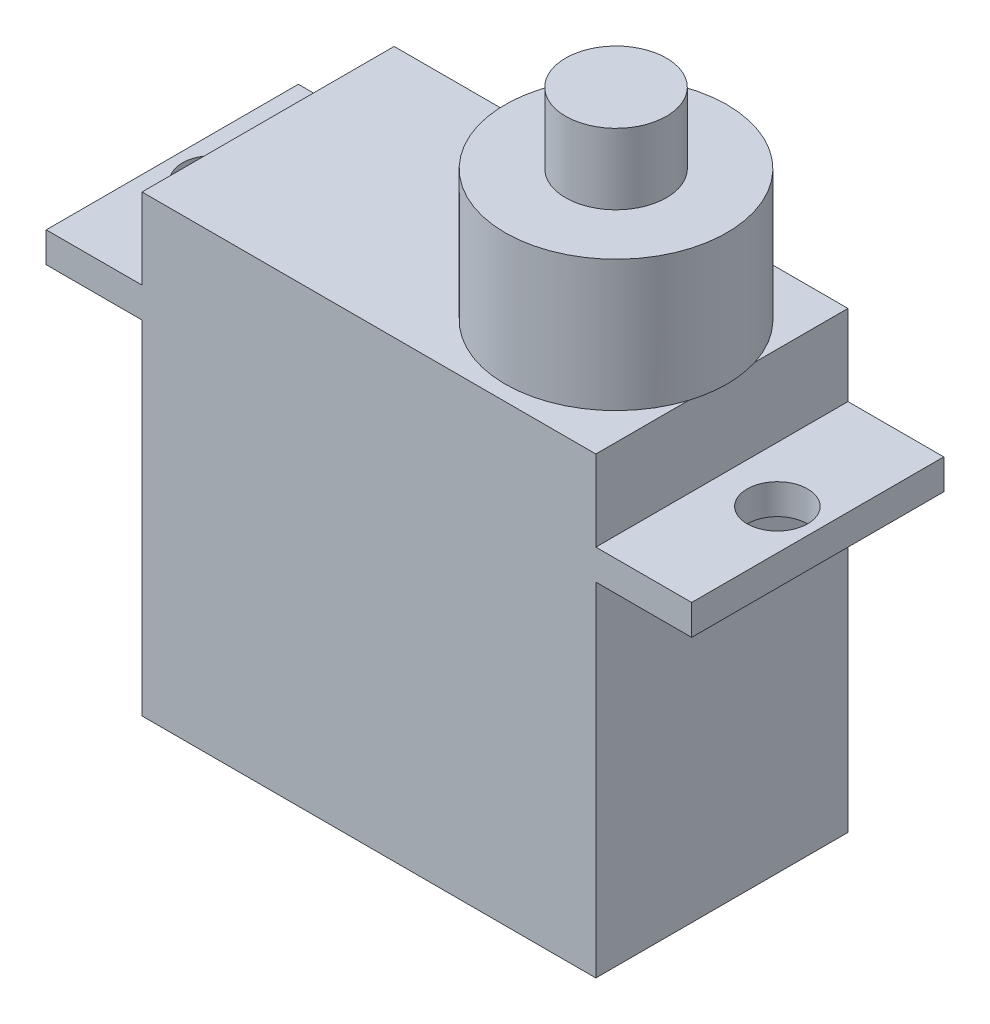
from build123d import *

# Parameters (mm, degrees)
SKETCH_1_W      = 22.5
SKETCH_1_H      = 12.5
EXTRUDE_1_DEPTH = 17
SKETCH_2_W      = 32
SKETCH_2_H      = 12.5
SKETCH_2_R      = 1.5
EXTRUDE_2_DEPTH = 1.5
SKETCH_3_W      = 22.5
SKETCH_3_H      = 12.5
EXTRUDE_3_DEPTH = 4
SKETCH_4_R      = 5.5
EXTRUDE_4_DEPTH = 6.5
SKETCH_5_R      = 2.5
EXTRUDE_5_DEPTH = 3.5


with BuildPart() as part:
    # 草图1 → 凸台-拉伸1 (new body)
    with BuildSketch(Plane(origin=(0, 0, 0), x_dir=(1, 0, 0), z_dir=(0, 1, 0))):
        with Locations((11.25, -6.25)):
            Rectangle(SKETCH_1_W, SKETCH_1_H)
    extrude(amount=EXTRUDE_1_DEPTH)

    # 草图2 → 凸台-拉伸2 (add)
    with BuildSketch(Plane(origin=(0, 17, 0), x_dir=(1, 0, 0), z_dir=(0, 1, 0))):
        with Locations((11.25, -6.25)):
            Rectangle(SKETCH_2_W, SKETCH_2_H)
        with Locations(Location((-2.75, -6.25, 0), (0, 0, 270))):
            Circle(SKETCH_2_R, mode=Mode.SUBTRACT)
        with Locations(Location((25.25, -6.25, 0), (0, 0, 270))):
            Circle(SKETCH_2_R, mode=Mode.SUBTRACT)
    extrude(amount=EXTRUDE_2_DEPTH)

    # 草图3 → 凸台-拉伸3 (add)
    with BuildSketch(Plane(origin=(0, 18.5, 0), x_dir=(1, 0, 0), z_dir=(0, 1, 0))):
        with Locations((11.25, -6.25)):
            Rectangle(SKETCH_3_W, SKETCH_3_H)
    extrude(amount=EXTRUDE_3_DEPTH)

    # 草图4 → 凸台-拉伸4 (add)
    with BuildSketch(Plane(origin=(0, 22.5, 0), x_dir=(1, 0, 0), z_dir=(0, 1, 0))):
        with Locations(Location((17.25, -6.25, 0), (0, 0, 17.341442803))):
            Circle(SKETCH_4_R)
    extrude(amount=EXTRUDE_4_DEPTH)

    # 草图5 → 凸台-拉伸5 (add)
    with BuildSketch(Plane(origin=(0, 29, 0), x_dir=(1, 0, 0), z_dir=(0, 1, 0))):
        with Locations(Location((17.25, -6.25, 0), (0, 0, 270))):
            Circle(SKETCH_5_R)
    extrude(amount=EXTRUDE_5_DEPTH)


solid = part.part
